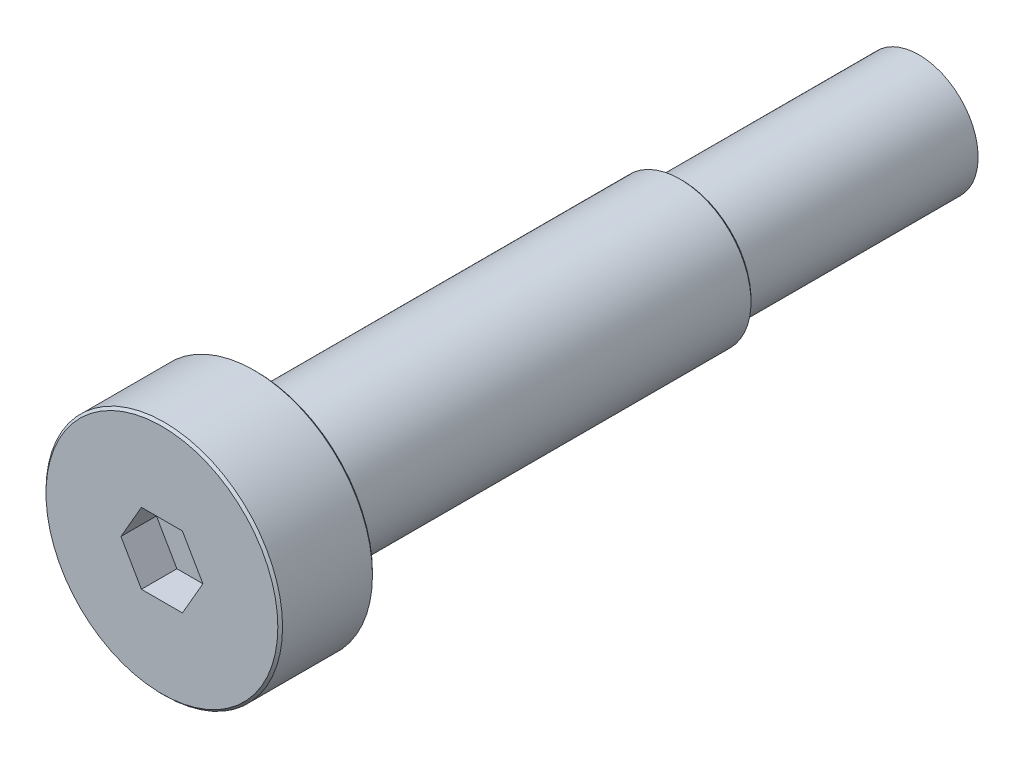
from build123d import *

# Parameters (mm, degrees)
SKETCH_1_R          = 5
EXTRUDE_1_DEPTH     = 4
SKETCH_2_R          = 3
EXTRUDE_2_DEPTH     = 18
SKETCH_3_R          = 2.5
EXTRUDE_3_DEPTH     = 10
CHAMFER_1_SIZE      = 0.1
CUT_EXTRUDE_1_DEPTH = 1.5


with BuildPart() as part:
    # 草图1 → 凸台-拉伸1 (new body)
    with BuildSketch(Plane.XY):
        Circle(SKETCH_1_R)
    extrude(amount=-EXTRUDE_1_DEPTH)

    # 草图2 → 凸台-拉伸2 (add)
    with BuildSketch(Plane(origin=(0, 0, -4), x_dir=(-1, 0, 0), z_dir=(0, 0, -1))):
        Circle(SKETCH_2_R)
    extrude(amount=EXTRUDE_2_DEPTH)

    # 草图3 → 凸台-拉伸3 (add)
    with BuildSketch(Plane(origin=(0, 0, -22), x_dir=(-1, 0, 0), z_dir=(0, 0, -1))):
        Circle(SKETCH_3_R)
    extrude(amount=EXTRUDE_3_DEPTH)

    # 倒角1
    chamfer_1_edges = [part.edges().sort_by_distance(p)[0] for p in [
        (-5, 0, 0),
        (-5, 0, -4),
        (3, 0, -22),
    ]]
    chamfer(chamfer_1_edges, length=CHAMFER_1_SIZE)

    # 草图4 → 切除-拉伸1 (cut)
    with BuildSketch(Plane.XY):
        Polygon((1.732050808, 0), (0.866025404, 1.5), (-0.866025404, 1.5), (-1.732050808, 0), (-0.866025404, -1.5), (0.866025404, -1.5), align=None)
    extrude(amount=-CUT_EXTRUDE_1_DEPTH, mode=Mode.SUBTRACT)


solid = part.part
